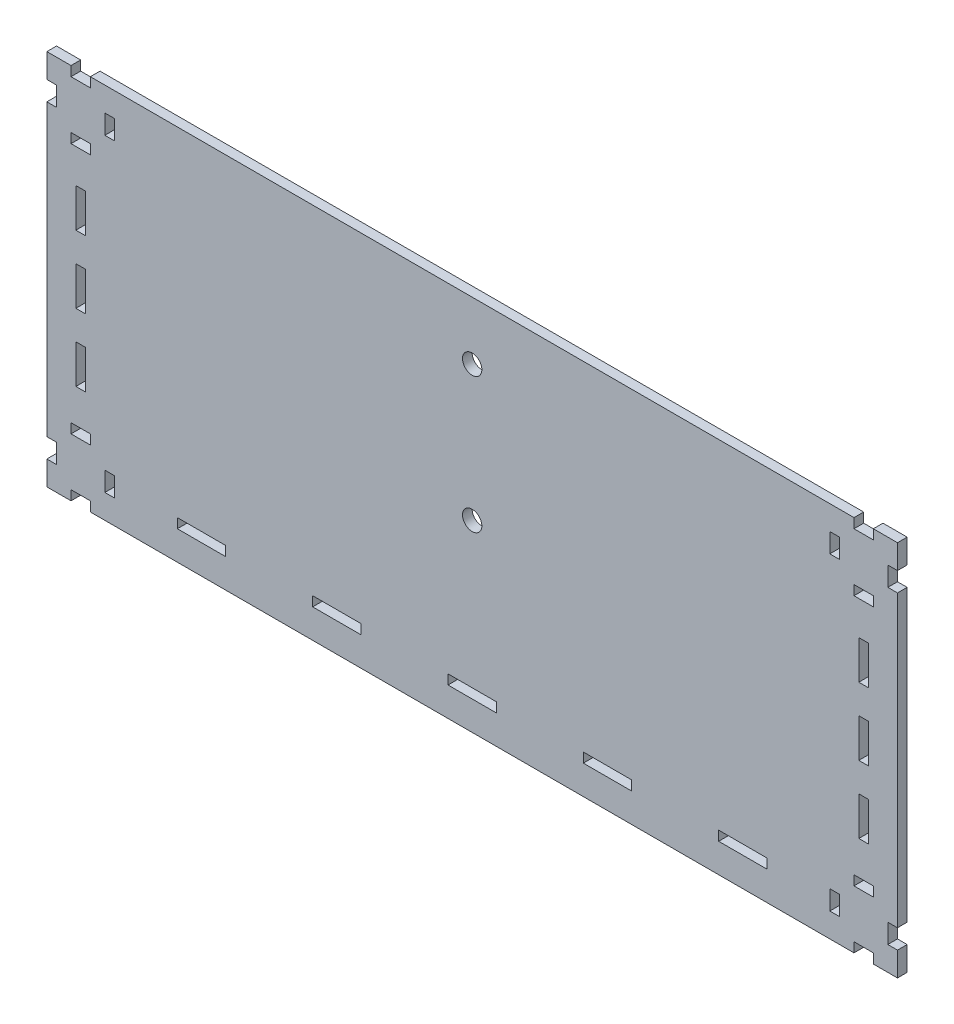
from build123d import *

# Parameters (mm, degrees)
SKETCH1_R           = 5
SKETCH1_W           = 10
SKETCH1_H           = 5
SKETCH1_W_2         = 4.999728605
SKETCH1_H_2         = 10
SKETCH1_W_3         = 5
SKETCH1_H_3         = 20
SKETCH1_W_4         = 25
BOSS_EXTRUDE1_DEPTH = 5


with BuildPart() as part:
    # Sketch1 → Boss-Extrude1 (new body)
    with BuildSketch(Plane.XY):
        Polygon((-5, 5), (-17.5, 5), (-17.5, 10), (-27.5, 10), (-27.5, 5), (-422.5, 5), (-422.5, 10), (-432.5, 10), (-432.5, 5), (-445, 5), (-445, 17.5), (-440, 17.5), (-440, 27.5), (-445, 27.5), (-445, 177.5), (-440, 177.5), (-440, 187.5), (-445, 187.5), (-445, 200), (-432.5, 200), (-432.5, 195), (-422.5, 195), (-422.5, 200), (-27.5, 200), (-27.5, 195), (-17.5, 195), (-17.5, 200), (-5, 200), (-5, 187.5), (-10, 187.5), (-10, 177.5), (-5, 177.5), (-5, 27.5), (-10, 27.5), (-10, 17.5), (-5, 17.5), align=None)
        with Locations((-225, 170)):
            Circle(SKETCH1_R, mode=Mode.SUBTRACT)
        with Locations((-225, 100)):
            Circle(SKETCH1_R, mode=Mode.SUBTRACT)
        with Locations((-22.5, 37.5)):
            Rectangle(SKETCH1_W, SKETCH1_H, mode=Mode.SUBTRACT)
        with Locations((-37.500135697, 22.5)):
            Rectangle(SKETCH1_W_2, SKETCH1_H_2, mode=Mode.SUBTRACT)
        with Locations((-412.499864302, 22.5)):
            Rectangle(SKETCH1_W_2, SKETCH1_H_2, mode=Mode.SUBTRACT)
        with Locations((-427.5, 37.5)):
            Rectangle(SKETCH1_W, SKETCH1_H, mode=Mode.SUBTRACT)
        with Locations((-427.5, 167.5)):
            Rectangle(SKETCH1_W, SKETCH1_H, mode=Mode.SUBTRACT)
        with Locations((-412.499864302, 182.5)):
            Rectangle(SKETCH1_W_2, SKETCH1_H_2, mode=Mode.SUBTRACT)
        with Locations((-37.500135697, 182.5)):
            Rectangle(SKETCH1_W_2, SKETCH1_H_2, mode=Mode.SUBTRACT)
        with Locations((-22.5, 167.5)):
            Rectangle(SKETCH1_W, SKETCH1_H, mode=Mode.SUBTRACT)
        with Locations((-427.5, 67.5)):
            Rectangle(SKETCH1_W_3, SKETCH1_H_3, mode=Mode.SUBTRACT)
        with Locations((-427.5, 102.5)):
            Rectangle(SKETCH1_W_3, SKETCH1_H_3, mode=Mode.SUBTRACT)
        with Locations((-427.5, 137.5)):
            Rectangle(SKETCH1_W_3, SKETCH1_H_3, mode=Mode.SUBTRACT)
        with Locations((-22.5, 137.5)):
            Rectangle(SKETCH1_W_3, SKETCH1_H_3, mode=Mode.SUBTRACT)
        with Locations((-22.5, 102.5)):
            Rectangle(SKETCH1_W_3, SKETCH1_H_3, mode=Mode.SUBTRACT)
        with Locations((-22.5, 67.5)):
            Rectangle(SKETCH1_W_3, SKETCH1_H_3, mode=Mode.SUBTRACT)
        with Locations((-365, 22.5)):
            Rectangle(SKETCH1_W_4, SKETCH1_H, mode=Mode.SUBTRACT)
        with Locations((-295, 22.5)):
            Rectangle(SKETCH1_W_4, SKETCH1_H, mode=Mode.SUBTRACT)
        with Locations((-225, 22.5)):
            Rectangle(SKETCH1_W_4, SKETCH1_H, mode=Mode.SUBTRACT)
        with Locations((-155, 22.5)):
            Rectangle(SKETCH1_W_4, SKETCH1_H, mode=Mode.SUBTRACT)
        with Locations((-85, 22.5)):
            Rectangle(SKETCH1_W_4, SKETCH1_H, mode=Mode.SUBTRACT)
    extrude(amount=BOSS_EXTRUDE1_DEPTH)


solid = part.part
